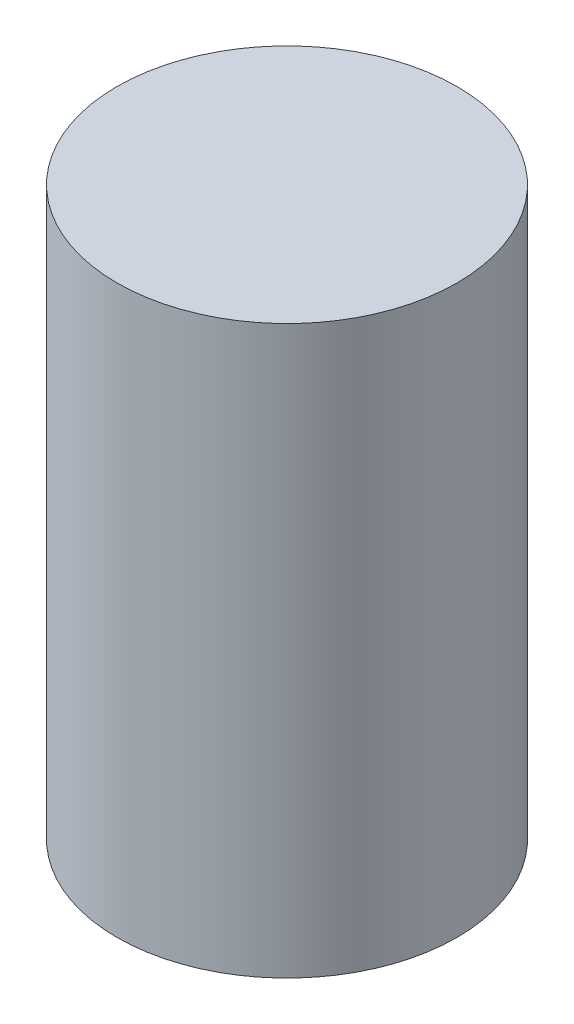
from build123d import *

# Parameters (mm, degrees)
SKETCH1_R           = 1.5
BOSS_EXTRUDE1_DEPTH = 5


with BuildPart() as part:
    # Sketch1 → Boss-Extrude1 (new body)
    with BuildSketch(Plane(origin=(0, 0, 0), x_dir=(1, 0, 0), z_dir=(0, 1, 0))):
        with Locations(Location((0, 0, 0), (0, 0, 270))):
            Circle(SKETCH1_R)
    extrude(amount=BOSS_EXTRUDE1_DEPTH)


solid = part.part
